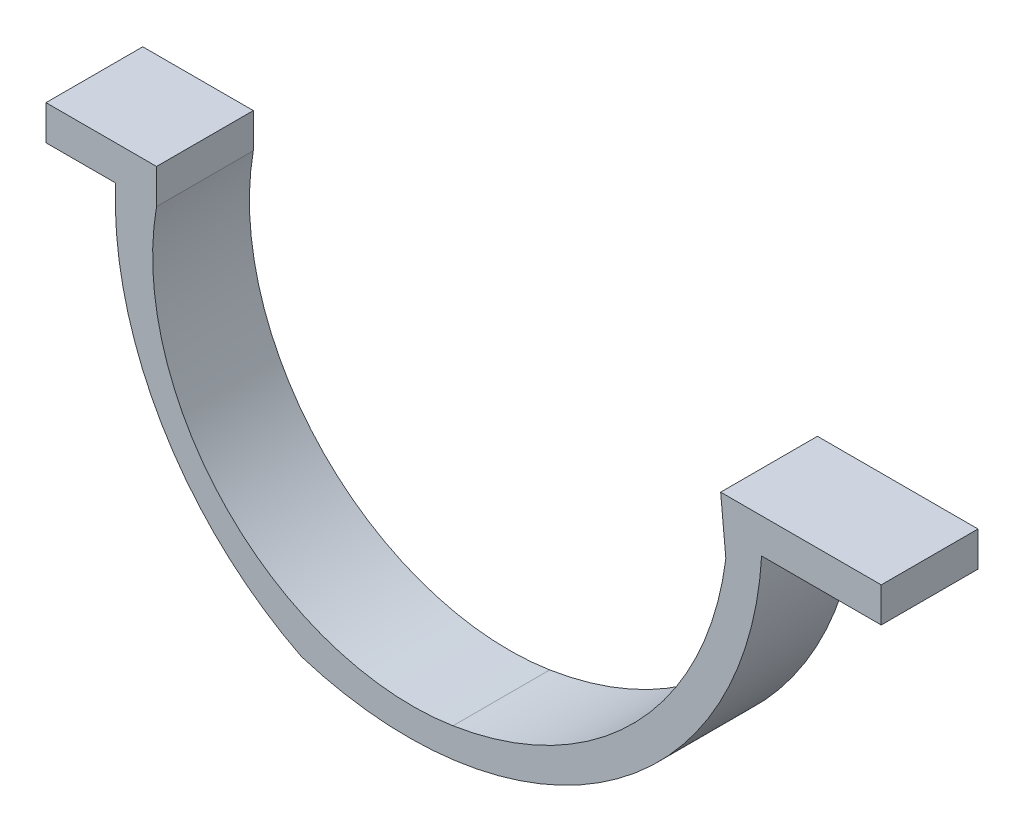
from build123d import *

# Parameters (mm, degrees)
EXTRUDE_1_DEPTH = 5


with BuildPart() as part:
    # 스케치1 → 보스-돌출1 (new, symmetric)
    with BuildSketch(Plane.XY):
        with BuildLine():
            Line((0, 0), (12.356704667, 0))
            Line((12.356704667, 0), (12.356704667, 3.595174958))
            Line((12.356704667, 3.595174958), (-4.233976366, 3.595174958))
            Line((-4.233976366, 3.595174958), (-3.698633078, -2.084492479))
            ThreePointArc((-3.698633078, -2.084492479), (-12.954718886, -21.310351029), (-31.892829031, -31.141767286))
            ThreePointArc((-31.892829031, -31.141767286), (-55.224518939, -23.45562289), (-62.523719203, 0))
            Line((-62.523719203, 0), (-62.523719203, 3.595174958))
            Line((-62.523719203, 3.595174958), (-73.944795268, 3.595174958))
            Line((-73.944795268, 3.595174958), (-73.944795268, 0))
            Line((-73.944795268, 0), (-66.753336801, 0))
            ThreePointArc((-66.753336801, 0), (-61.985172369, -19.214758492), (-47.563771697, -32.778148135))
            ThreePointArc((-47.563771697, -32.778148135), (-15.773872786, -28.009355466), (0, 0))
        make_face()
    extrude(amount=EXTRUDE_1_DEPTH, both=True)


solid = part.part
